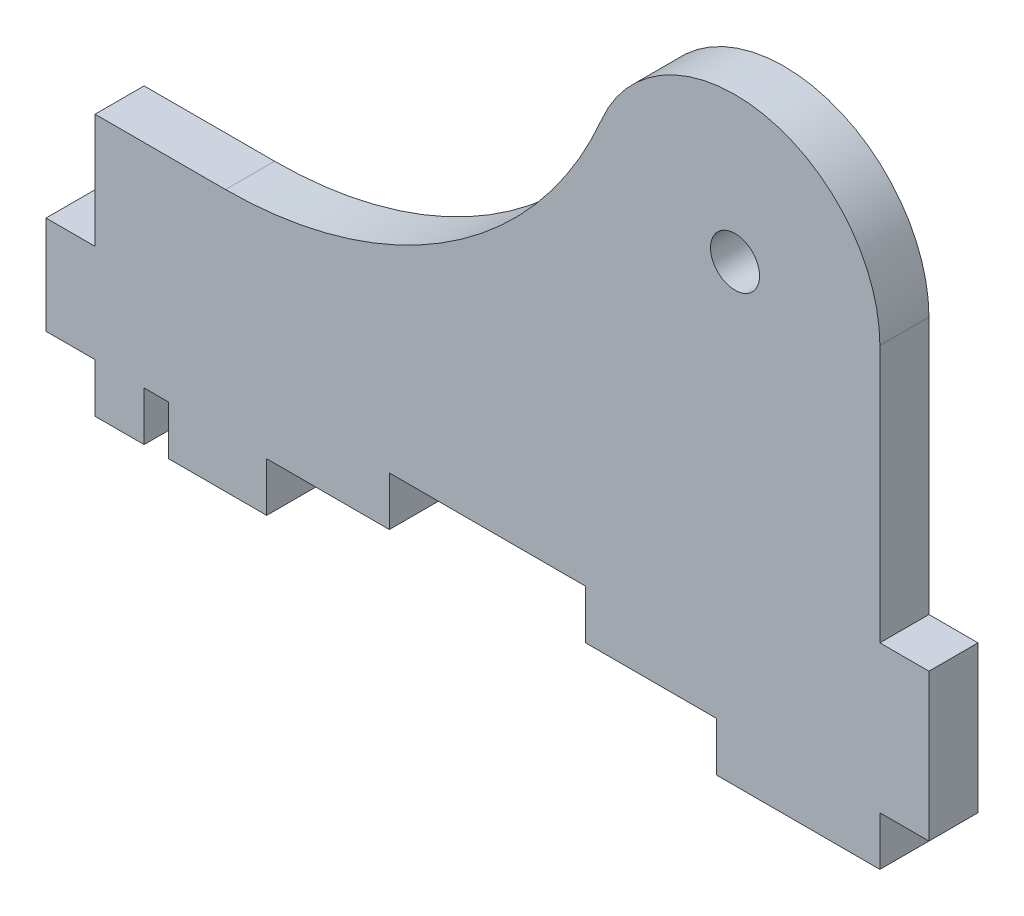
from build123d import *

# Parameters (mm, degrees)
RESSALTO_EXTRUS_O1_DEPTH   = 3
ESBO_O2_W                  = 12
ESBO_O2_H                  = 3
CORTE_EXTRUS_O1_DEPTH      = 59.67394737
FURO_DE_DI_METRO_3_0_3_1_D = 3
ESBO_O5_W                  = 3
ESBO_O5_H                  = 6
ESBO_O5_H_2                = 3
ESBO_O5_W_2                = 6
ESBO_O5_H_3                = 9
ESBO_O5_W_3                = 10
RESSALTO_EXTRUS_O2_DEPTH   = 3


with BuildPart() as part:
    # Esboço1 → Ressalto-extrusão1 (new body)
    with BuildSketch(Plane.XY):
        with BuildLine():
            Line((0, 0), (48, 0))
            Line((48, 0), (48, 24.75))
            ThreePointArc((48, 24.75), (40.90916402, 33.431570058), (30.986533031, 28.217070289))
            ThreePointArc((30.986533031, 28.217070289), (21.771923029, 17.148462374), (7.980136393, 13))
            Line((7.980136393, 13), (0, 13))
            Line((0, 13), (0, 0))
        make_face()
    extrude(amount=-RESSALTO_EXTRUS_O1_DEPTH)

    # Esboço2 → Corte-extrusão1 (cut, through all)
    with BuildSketch(Plane.XY):
        with Locations((24, 1.5)):
            Rectangle(ESBO_O2_W, ESBO_O2_H)
    extrude(amount=-CORTE_EXTRUS_O1_DEPTH, mode=Mode.SUBTRACT)

    # Furo de diâmetro Ø3.0 (3)1 (through all)
    with Locations(Plane.XY):
        with Locations((39.14, 24.75)):
            Hole(FURO_DE_DI_METRO_3_0_3_1_D / 2)

    # Esboço5 → Ressalto-extrusão2 (add, through all)
    with BuildSketch(Plane.XY):
        with Locations((-1.5, 3)):
            Rectangle(ESBO_O5_W, ESBO_O5_H)
        with Locations((1.5, -1.5)):
            Rectangle(ESBO_O5_W, ESBO_O5_H_2)
        with Locations((7.5, -1.5)):
            Rectangle(ESBO_O5_W_2, ESBO_O5_H_2)
        with Locations((49.5, 4.5)):
            Rectangle(ESBO_O5_W, ESBO_O5_H_3)
        with Locations((43, -1.5)):
            Rectangle(ESBO_O5_W_3, ESBO_O5_H_2)
    extrude(amount=-RESSALTO_EXTRUS_O2_DEPTH)


solid = part.part
